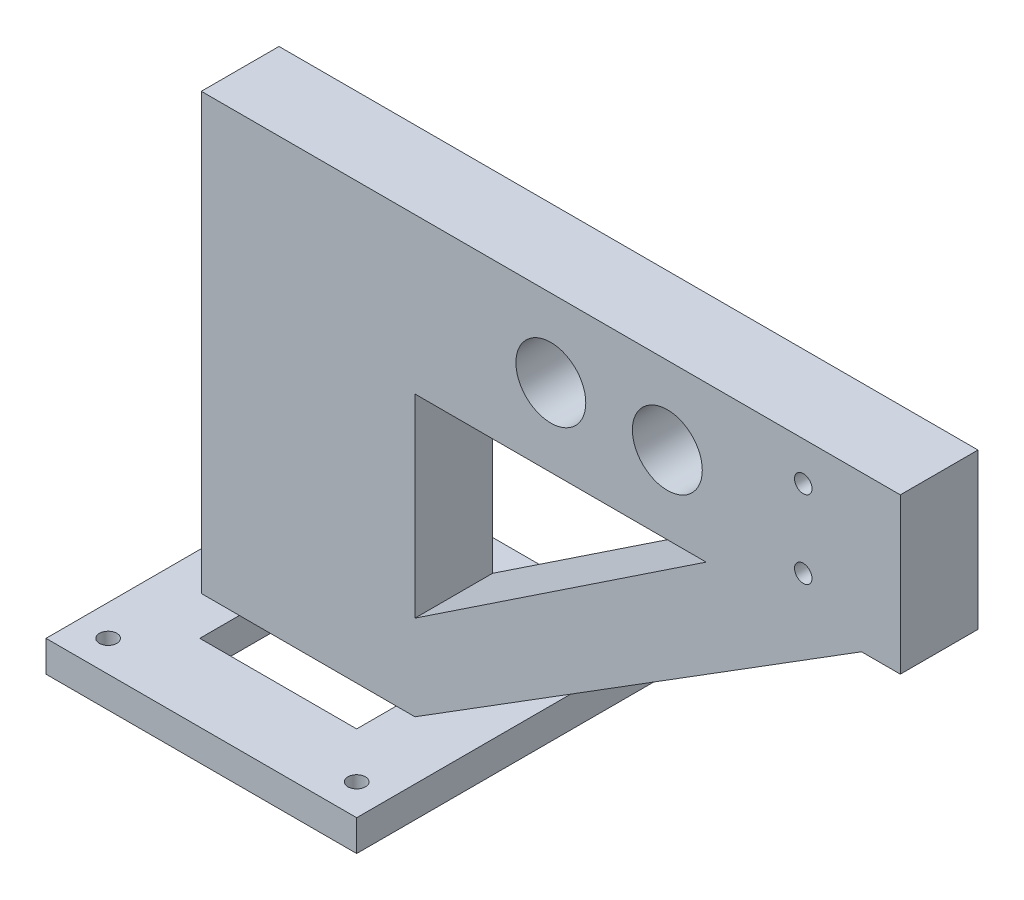
from build123d import *

# Parameters (mm, degrees)
SKETCH_1_W                  = 80
SKETCH_1_H                  = 80
SKETCH_1_W_2                = 40.4
SKETCH_1_H_2                = 40.4
EXTRUDE_273_DEPTH           = 8
EXTRUDE_START               = -10
EXTRUDE_351_DEPTH           = 20
CUT_EXTRUDE_442_DEPTH       = 197.214168703
CUT_EXTRUDE_442_DEPTH_BACK  = 197.214168703
CUT_EXTRUDE_500_DEPTH       = 197.214168703
CUT_EXTRUDE_500_DEPTH_BACK  = 197.214168703
SKETCH_4_R                  = 9
CUT_EXTRUDE_M4_DEPTH        = 197.214168703
CUT_EXTRUDE_M4_DEPTH_BACK   = 197.214168703
SKETCH_5_R                  = 2.25
CUT_EXTRUDE_M4_2_DEPTH      = 197.214168703
CUT_EXTRUDE_M4_2_DEPTH_BACK = 197.214168703
SKETCH_6_R                  = 2.25


with BuildPart() as part:
    # 草图1 → Extrude 273 (new body)
    with BuildSketch(Plane(origin=(0, 0, 0), x_dir=(1, 0, 0), z_dir=(0, 1, 0))):
        Rectangle(SKETCH_1_W, SKETCH_1_H)
        Rectangle(SKETCH_1_W_2, SKETCH_1_H_2, mode=Mode.SUBTRACT)
    extrude(amount=EXTRUDE_273_DEPTH)

    # 草图2 → Extrude 351 (add)
    with BuildSketch(Plane.XY.offset(EXTRUDE_START)):
        Polygon((-30, 8), (25, 8), (140, 80), (150, 80), (150, 120), (-30, 120), align=None)
    extrude(amount=EXTRUDE_351_DEPTH)

    # 草图3 → Cut-Extrude 442 (cut, two sides: drawn at the far end of the back side and taken through both)
    with BuildSketch(Plane.XY.offset(-CUT_EXTRUDE_442_DEPTH_BACK)):
        Polygon((25, 30), (100, 80), (25, 80), align=None)
    extrude(amount=CUT_EXTRUDE_442_DEPTH + CUT_EXTRUDE_442_DEPTH_BACK, mode=Mode.SUBTRACT)

    # 草图4 → Cut-Extrude 500 (cut, two sides: drawn at the far end of the back side and taken through both)
    with BuildSketch(Plane.XY.offset(-CUT_EXTRUDE_500_DEPTH_BACK)):
        with Locations((60, 100)):
            Circle(SKETCH_4_R)
        with Locations((90, 100)):
            Circle(SKETCH_4_R)
    extrude(amount=CUT_EXTRUDE_500_DEPTH + CUT_EXTRUDE_500_DEPTH_BACK, mode=Mode.SUBTRACT)

    # 草图5 → Cut-Extrude M4 (cut, two sides: drawn at the far end of the back side and taken through both)
    with BuildSketch(Plane.XY.offset(-CUT_EXTRUDE_M4_DEPTH_BACK)):
        with Locations((125, 90)):
            Circle(SKETCH_5_R)
        with Locations((125, 110)):
            Circle(SKETCH_5_R)
    extrude(amount=CUT_EXTRUDE_M4_DEPTH + CUT_EXTRUDE_M4_DEPTH_BACK, mode=Mode.SUBTRACT)

    # 草图6 → Cut-Extrude M4 2 (cut, two sides: drawn at the far end of the back side and taken through both)
    with BuildSketch(Plane(origin=(0, 0, 0), x_dir=(1, 0, 0), z_dir=(0, 1, 0)).offset(-CUT_EXTRUDE_M4_2_DEPTH_BACK)):
        with Locations(Location((-32, -32, 0), (0, 0, 270))):
            Circle(SKETCH_6_R)
        with Locations(Location((-32, 32, 0), (0, 0, 270))):
            Circle(SKETCH_6_R)
        with Locations(Location((32, -32, 0), (0, 0, 270))):
            Circle(SKETCH_6_R)
        with Locations(Location((32, 32, 0), (0, 0, 270))):
            Circle(SKETCH_6_R)
    extrude(amount=CUT_EXTRUDE_M4_2_DEPTH + CUT_EXTRUDE_M4_2_DEPTH_BACK, mode=Mode.SUBTRACT)


solid = part.part
